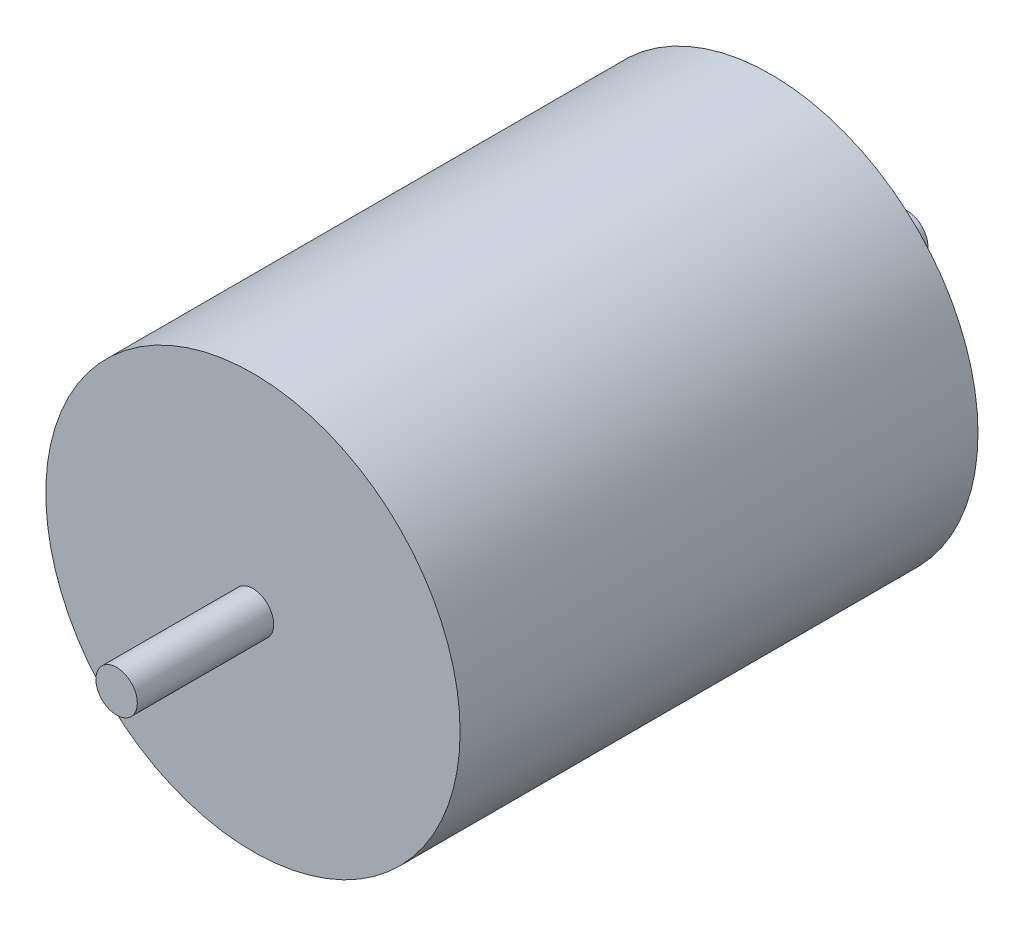
from build123d import *

# Parameters (mm, degrees)
SKETCH1_R           = 6
SKETCH1_R_2         = 0.6
BOSS_EXTRUDE1_DEPTH = 7.5
SKETCH1_2_R         = 0.6
BOSS_EXTRUDE2_DEPTH = 11.45


with BuildPart() as part:
    # Sketch1 → Boss-Extrude1 (new, symmetric)
    with BuildSketch(Plane.XY):
        Circle(SKETCH1_R)
        Circle(SKETCH1_R_2, mode=Mode.SUBTRACT)
    extrude(amount=BOSS_EXTRUDE1_DEPTH, both=True)

    # Sketch1<2> → Boss-Extrude2 (add, symmetric)
    with BuildSketch(Plane.XY):
        Circle(SKETCH1_2_R)
    extrude(amount=BOSS_EXTRUDE2_DEPTH, both=True)


solid = part.part
